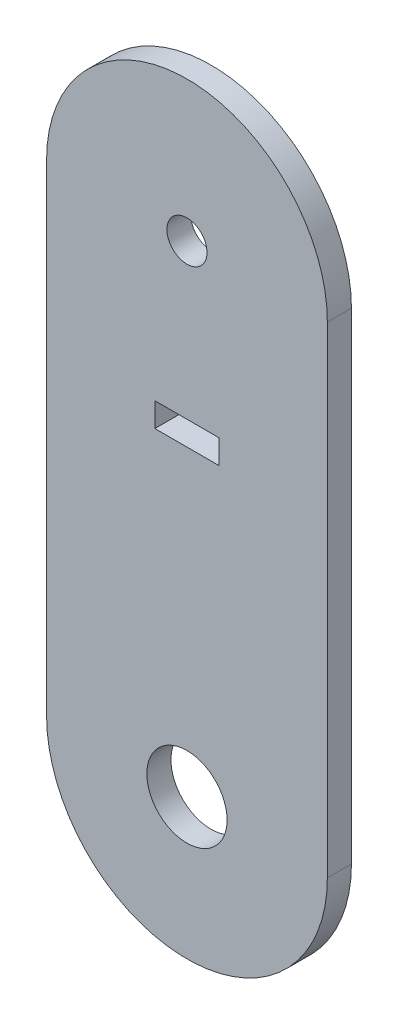
from build123d import *

# Parameters (mm, degrees)
SALIENTE_EXTRUIR1_DEPTH           = 3
CORTAR_EXTRUIR1_REACH             = 52.71
CROQUIS3_R                        = 2.5
CROQUIS3_R_2                      = 5
CORTAR_EXTRUIR2_REACH             = 52.71
CROQUIS4_W                        = 8
CROQUIS4_H                        = 3
CORTAR_EXTRUIR2_DIRECTION_2_DEPTH = 51.709959574


with BuildPart() as part:
    # Croquis1 → Saliente-Extruir1 (new body)
    with BuildSketch(Plane.XY):
        with BuildLine():
            Line((-17.5, -30), (-17.5, 30))
            ThreePointArc((-17.5, 30), (0, 47.5), (17.5, 30))
            Line((17.5, 30), (17.5, -30))
            ThreePointArc((17.5, -30), (0, -47.5), (-17.5, -30))
        make_face()
    extrude(amount=SALIENTE_EXTRUIR1_DEPTH)

    # Croquis3 → Cortar-Extruir1 (cut, up to next)
    with BuildSketch(Plane.XY.offset(3), mode=Mode.PRIVATE) as cortar_extruir1_sk1:
        with Locations((0, 30)):
            Circle(CROQUIS3_R)
    cortar_extruir1_tool1 = extrude(cortar_extruir1_sk1.sketch, amount=-CORTAR_EXTRUIR1_REACH, mode=Mode.PRIVATE) & part.part
    # Croquis3 → Cortar-Extruir1 (cut, up to next)
    with BuildSketch(Plane.XY.offset(3), mode=Mode.PRIVATE) as cortar_extruir1_sk2:
        with Locations((0, -30)):
            Circle(CROQUIS3_R_2)
    cortar_extruir1_tool2 = extrude(cortar_extruir1_sk2.sketch, amount=-CORTAR_EXTRUIR1_REACH, mode=Mode.PRIVATE) & part.part
    add(cortar_extruir1_tool1.solids().sort_by_distance((0, 30, 3))[0], mode=Mode.SUBTRACT)
    add(cortar_extruir1_tool2.solids().sort_by_distance((0, -30, 3))[0], mode=Mode.SUBTRACT)

    # Croquis4 → Cortar-Extruir2 (cut, up to next)
    with BuildSketch(Plane.XY.offset(3), mode=Mode.PRIVATE) as cortar_extruir2_sk1:
        with Locations((0, 9.26)):
            Rectangle(CROQUIS4_W, CROQUIS4_H)
    cortar_extruir2_tool1 = extrude(cortar_extruir2_sk1.sketch, amount=-CORTAR_EXTRUIR2_REACH, mode=Mode.PRIVATE) & part.part
    add(cortar_extruir2_tool1.solids().sort_by_distance((0, 9.26, 3))[0], mode=Mode.SUBTRACT)

    # Croquis4 → Cortar-Extruir2 direction 2 (cut)
    with BuildSketch(Plane.XY.offset(3)):
        with Locations((0, 9.26)):
            Rectangle(CROQUIS4_W, CROQUIS4_H)
    extrude(amount=CORTAR_EXTRUIR2_DIRECTION_2_DEPTH, mode=Mode.SUBTRACT)


solid = part.part
